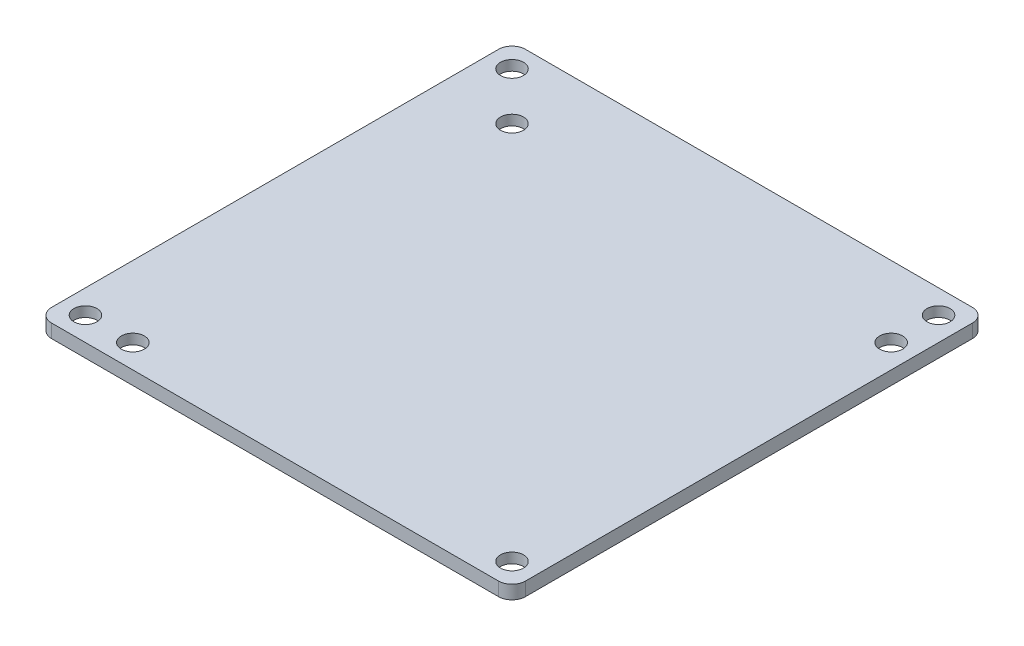
from build123d import *

# Parameters (mm, degrees)
SKETCH_1_W          = 70
SKETCH_1_H          = 70
SKETCH_1_R          = 1.7
EXTRUDE_1_DEPTH     = 2
FILLET_1_R          = 2
SKETCH_2_R          = 2.5
SKETCH_2_R_2        = 1.7
CUT_EXTRUDE_1_DEPTH = 0.5


with BuildPart() as part:
    # 草图1 → 凸台-拉伸1 (new body)
    with BuildSketch(Plane(origin=(0, 0, 0), x_dir=(1, 0, 0), z_dir=(0, 1, 0))):
        with Locations((-3.5, 3.5)):
            Rectangle(SKETCH_1_W, SKETCH_1_H)
        with Locations(Location((-28, -28, 0), (0, 0, 270))):
            Circle(SKETCH_1_R, mode=Mode.SUBTRACT)
        with Locations(Location((28, -28, 0), (0, 0, 270))):
            Circle(SKETCH_1_R, mode=Mode.SUBTRACT)
        with Locations(Location((28, 28, 0), (0, 0, 270))):
            Circle(SKETCH_1_R, mode=Mode.SUBTRACT)
        with Locations(Location((-28, 28, 0), (0, 0, 270))):
            Circle(SKETCH_1_R, mode=Mode.SUBTRACT)
        with Locations(Location((28, 35, 0), (0, 0, 270))):
            Circle(SKETCH_1_R, mode=Mode.SUBTRACT)
        with Locations(Location((-35, -28, 0), (0, 0, 90))):
            Circle(SKETCH_1_R, mode=Mode.SUBTRACT)
        with Locations(Location((-35, 35, 0), (0, 0, 90))):
            Circle(SKETCH_1_R, mode=Mode.SUBTRACT)
    extrude(amount=EXTRUDE_1_DEPTH)

    # 圆角1
    fillet_1_edges = [part.edges().sort_by_distance(p)[0] for p in [
        (-38.5, 1, -38.5),
        (31.5, 1, -38.5),
        (31.5, 1, 31.5),
        (-38.5, 1, 31.5),
    ]]
    fillet(fillet_1_edges, radius=FILLET_1_R)

    # 草图2 → 切除-拉伸1 (cut)
    # profile 1 of 7: a face of its own
    with BuildSketch(Plane.XZ):
        with Locations(Location((-28, 28, 0), (0, 0, 270))):
            Circle(SKETCH_2_R)
        with Locations(Location((-28, 28, 0), (0, 0, 270))):
            Circle(SKETCH_2_R_2, mode=Mode.SUBTRACT)
    # profile 2 of 7: a face of its own
    with BuildSketch(Plane.XZ):
        with Locations(Location((-35, 28, 0), (0, 0, 270))):
            Circle(SKETCH_2_R)
        with Locations(Location((-35, 28, 0), (0, 0, 270))):
            Circle(SKETCH_2_R_2, mode=Mode.SUBTRACT)
    # profile 3 of 7: a face of its own
    with BuildSketch(Plane.XZ):
        with Locations(Location((28, 28, 0), (0, 0, 270))):
            Circle(SKETCH_2_R)
        with Locations(Location((28, 28, 0), (0, 0, 270))):
            Circle(SKETCH_2_R_2, mode=Mode.SUBTRACT)
    # profile 4 of 7: a face of its own
    with BuildSketch(Plane.XZ):
        with Locations(Location((28, -28, 0), (0, 0, 270))):
            Circle(SKETCH_2_R)
        with Locations(Location((28, -28, 0), (0, 0, 270))):
            Circle(SKETCH_2_R_2, mode=Mode.SUBTRACT)
    # profile 5 of 7: a face of its own
    with BuildSketch(Plane.XZ):
        with Locations(Location((28, -35, 0), (0, 0, 270))):
            Circle(SKETCH_2_R)
        with Locations(Location((28, -35, 0), (0, 0, 270))):
            Circle(SKETCH_2_R_2, mode=Mode.SUBTRACT)
    # profile 6 of 7: a face of its own
    with BuildSketch(Plane.XZ):
        with Locations(Location((-28, -28, 0), (0, 0, 270))):
            Circle(SKETCH_2_R)
        with Locations(Location((-28, -28, 0), (0, 0, 270))):
            Circle(SKETCH_2_R_2, mode=Mode.SUBTRACT)
    # profile 7 of 7: a face of its own
    with BuildSketch(Plane.XZ):
        with Locations(Location((-35, -35, 0), (0, 0, 270))):
            Circle(SKETCH_2_R)
        with Locations(Location((-35, -35, 0), (0, 0, 270))):
            Circle(SKETCH_2_R_2, mode=Mode.SUBTRACT)
    extrude(amount=-CUT_EXTRUDE_1_DEPTH, mode=Mode.SUBTRACT)


solid = part.part
